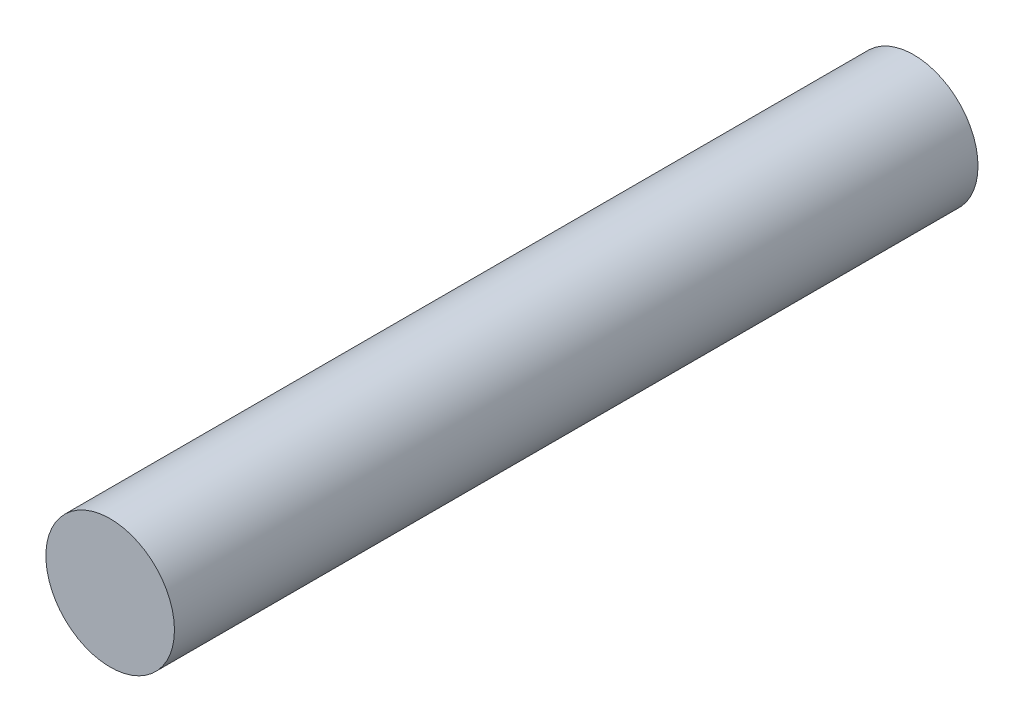
from build123d import *

# Parameters (mm, degrees)
SKETCH1_R           = 2.4
BOSS_EXTRUDE1_DEPTH = 30


with BuildPart() as part:
    # Sketch1 → Boss-Extrude1 (new body)
    with BuildSketch(Plane.XY):
        Circle(SKETCH1_R)
    extrude(amount=BOSS_EXTRUDE1_DEPTH)


solid = part.part
